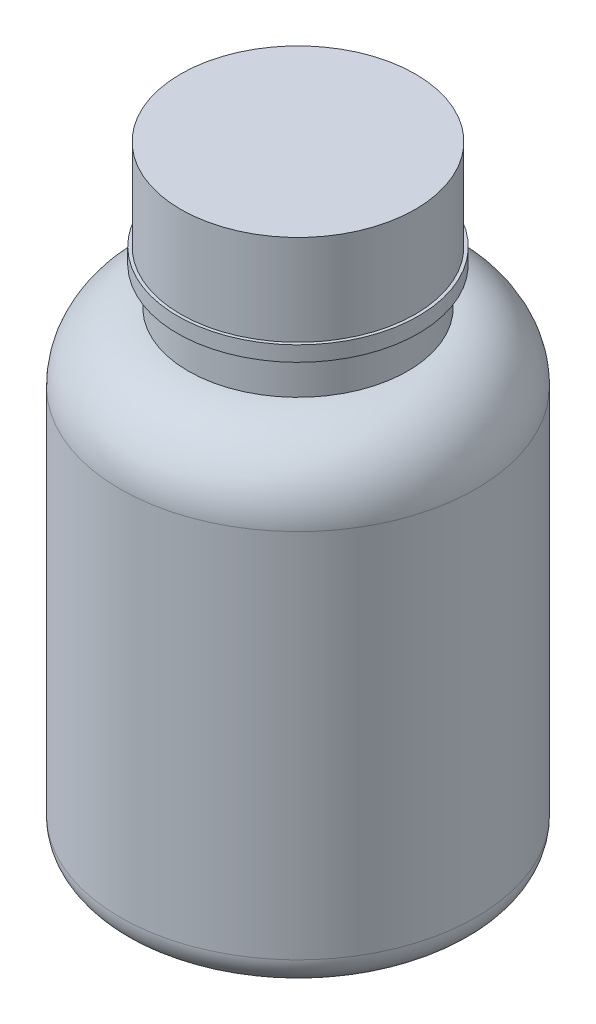
from build123d import *


with BuildPart() as part:
    # 草图1 → 旋转1 (revolve)
    with BuildSketch(Plane.XY, mode=Mode.PRIVATE) as revolve_1_sk:
        with BuildLine():
            Line((0, 56), (0, -25))
            Line((0, -25), (19.5, -25))
            ThreePointArc((19.5, -25), (22.328427125, -23.828427125), (23.5, -21))
            Line((23.5, -21), (23.5, 25))
            Line((23.5, 25), (23.5, 28))
            ThreePointArc((23.5, 28), (20.863961031, 34.363961031), (14.5, 37))
            Line((14.5, 37), (14.5, 42))
            Line((14.5, 42), (15.90903206, 42))
            Line((15.90903206, 42), (15.90903206, 44))
            Line((15.90903206, 44), (15.5, 44))
            Line((15.5, 44), (15.5, 56))
            Line((15.5, 56), (0, 56))
        make_face()
    revolve(revolve_1_sk.sketch.rotate(Axis((0, 0, 0), (0, 1, 0)), 90), axis=Axis((0, 0, 0), (0, 1, 0)))


solid = part.part
